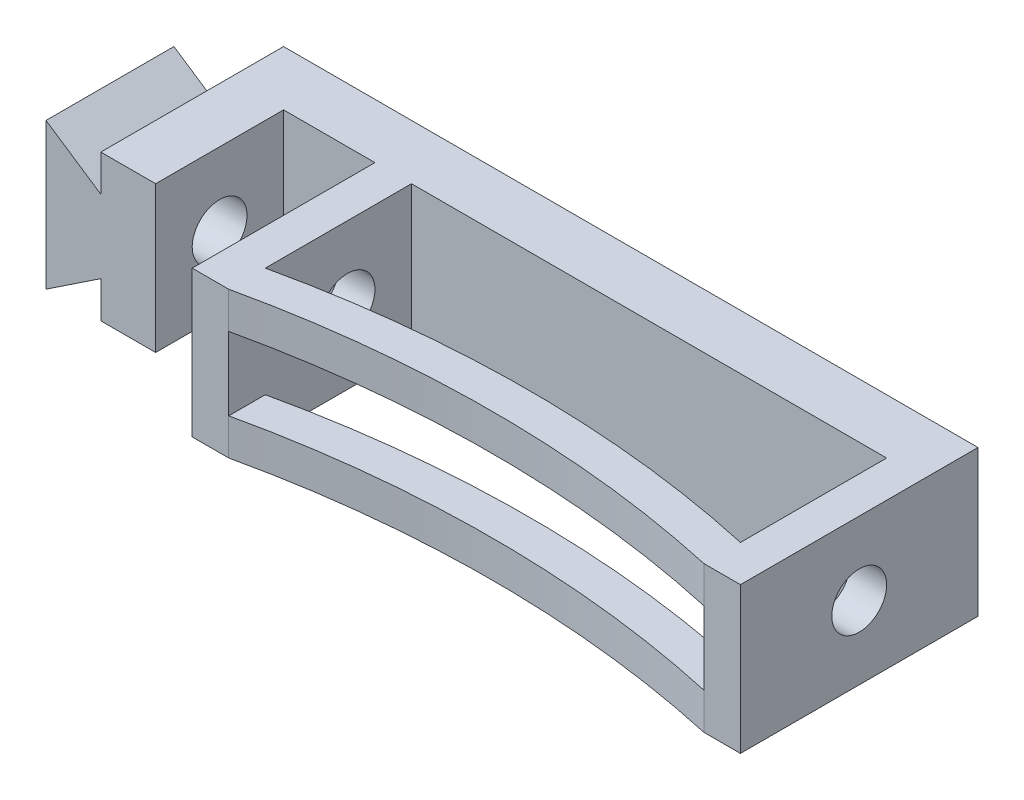
from build123d import *

# Parameters (mm, degrees)
SKETCH_1_W                      = 35
SKETCH_1_H                      = 8
EXTRUDE_2_DEPTH                 = 10
CUT_EXTRUDE_4_DEPTH             = 3
SKETCH_11_W                     = 35
SKETCH_11_H                     = 8
CUT_EXTRUDE_5_DEPTH             = 7
SKETCH_14_W                     = 2
SKETCH_14_H                     = 8
EXTRUDE_7_DEPTH                 = 10
CUT_EXTRUDE_6_DEPTH             = 38.815340802
CUT_EXTRUDE_6_DEPTH_BACK        = 3
SKETCH_12_R                     = 1.5
EXTRUDE_10_DEPTH                = 8
CUT_EXTRUDE_8_REACH             = 42.608
SKETCH_31_W                     = 26
SKETCH_31_H                     = 4
CUT_EXTRUDE_8_DIRECTION_2_DEPTH = 41.607881008


with BuildPart() as part:
    # 草图1 → 凸台-拉伸2 (new body)
    with BuildSketch(Plane.XY):
        Polygon((0, 4), (-3, 6), (-3, 2), (0, 2), align=None)
        Polygon((0, 6), (0, 4), (0, 0), (0, -2), (3, -2), (3, 6), align=None)
        Polygon((0, 2), (-3, 2), (-3, -2), (0, 0), align=None)
        with Locations((20.5, 2)):
            Rectangle(SKETCH_1_W, SKETCH_1_H)
    extrude(amount=EXTRUDE_2_DEPTH)

    # 草图1<4> → 切除-拉伸4 (cut)
    with BuildSketch(Plane.XY):
        Polygon((0, 4), (-3, 6), (-3, 2), (0, 2), align=None)
        Polygon((0, 2), (-3, 2), (-3, -2), (0, 0), align=None)
    extrude(amount=CUT_EXTRUDE_4_DEPTH, mode=Mode.SUBTRACT)

    # 草图11 → 切除-拉伸5 (cut)
    with BuildSketch(Plane.XY.offset(10)):
        with Locations((20.5, 2)):
            Rectangle(SKETCH_11_W, SKETCH_11_H)
    extrude(amount=-CUT_EXTRUDE_5_DEPTH, mode=Mode.SUBTRACT)

    # 草图14 → 凸台-拉伸7 (add)
    with BuildSketch(Plane.XY.offset(3)):
        with Locations((37, 2)):
            Rectangle(SKETCH_14_W, SKETCH_14_H)
        with Locations((9, 2)):
            Rectangle(SKETCH_14_W, SKETCH_14_H)
    extrude(amount=EXTRUDE_7_DEPTH)

    # 草图12 → 切除-拉伸6 (cut, two sides: drawn at the far end of the back side and taken through both)
    with BuildSketch(Plane(origin=(3, 0, 0), x_dir=(0, 0, -1), z_dir=(1, 0, 0)).offset(-CUT_EXTRUDE_6_DEPTH_BACK)):
        with Locations((-6.5, 2)):
            Circle(SKETCH_12_R)
    extrude(amount=CUT_EXTRUDE_6_DEPTH + CUT_EXTRUDE_6_DEPTH_BACK, mode=Mode.SUBTRACT)

    # 草图30 → 凸台-拉伸10 (add)
    with BuildSketch(Plane(origin=(0, 6, 0), x_dir=(1, 0, 0), z_dir=(0, 1, 0))):
        with BuildLine():
            Line((10, -11), (10, -13))
            ThreePointArc((10, -13), (23, -11.574738582), (36, -13))
            Line((36, -13), (36, -11))
            ThreePointArc((36, -11), (23, -9.574738582), (10, -11))
        make_face()
    extrude(amount=-EXTRUDE_10_DEPTH)

    # 草图31 → 切除-拉伸8 (cut, up to next)
    with BuildSketch(Plane.XY.offset(13), mode=Mode.PRIVATE) as cut_extrude_8_sk1:
        with Locations((23, 2)):
            Rectangle(SKETCH_31_W, SKETCH_31_H)
    cut_extrude_8_tool1 = extrude(cut_extrude_8_sk1.sketch, amount=-CUT_EXTRUDE_8_REACH, mode=Mode.PRIVATE) & part.part
    add(cut_extrude_8_tool1.solids().sort_by_distance((23, 2, 13))[0], mode=Mode.SUBTRACT)

    # 草图31 → 切除-拉伸8 direction 2 (cut)
    with BuildSketch(Plane.XY.offset(13)):
        with Locations((23, 2)):
            Rectangle(SKETCH_31_W, SKETCH_31_H)
    extrude(amount=CUT_EXTRUDE_8_DIRECTION_2_DEPTH, mode=Mode.SUBTRACT)


solid = part.part
